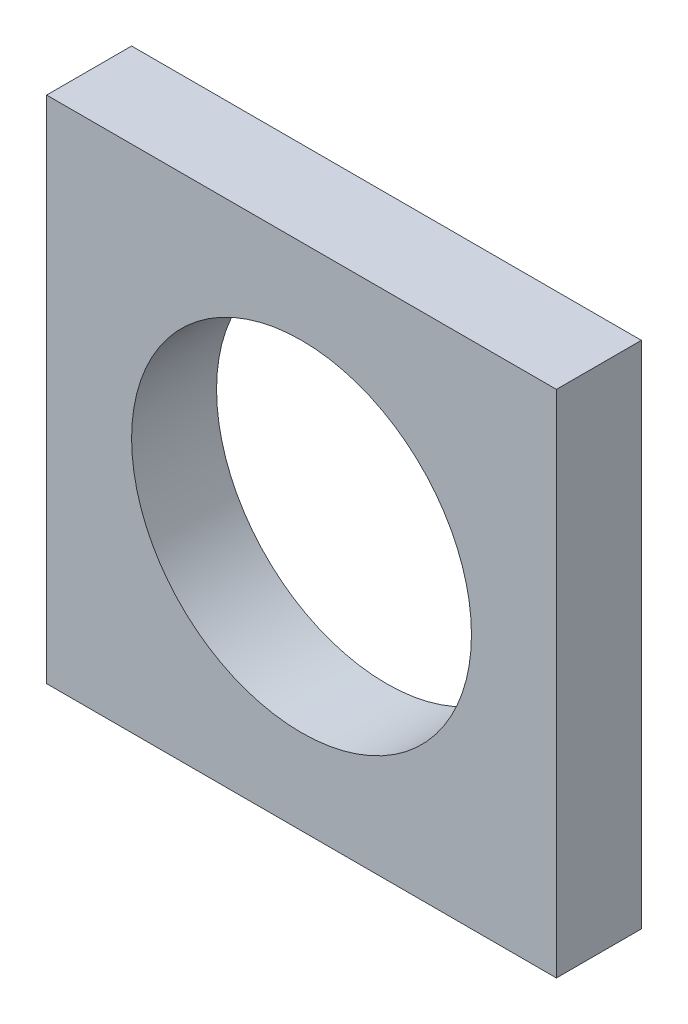
from build123d import *

# Parameters (mm, degrees)
SKETCH_1_W      = 6
SKETCH_1_H      = 6
SKETCH_1_R      = 2
EXTRUDE_1_DEPTH = 0.5


with BuildPart() as part:
    # 草图1 → 凸台-拉伸1 (new, symmetric)
    with BuildSketch(Plane.XY):
        with Locations((3, 3)):
            Rectangle(SKETCH_1_W, SKETCH_1_H)
        with Locations((3, 3)):
            Circle(SKETCH_1_R, mode=Mode.SUBTRACT)
    extrude(amount=EXTRUDE_1_DEPTH, both=True)


solid = part.part
